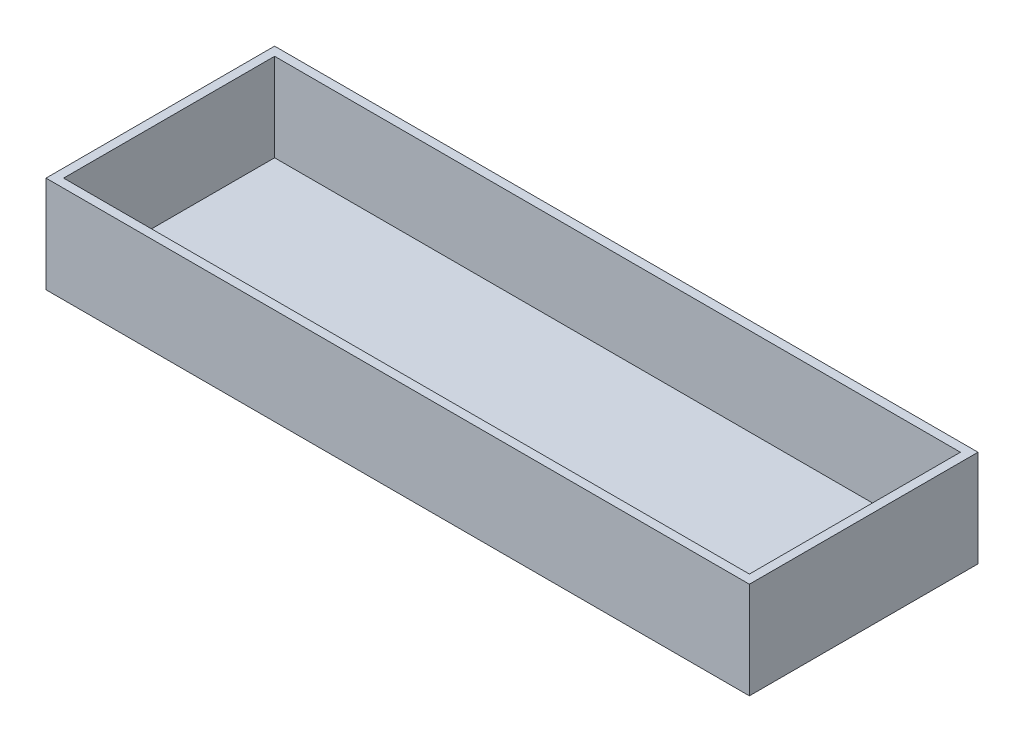
from build123d import *

# Parameters (mm, degrees)
SKETCH1_W           = 160
SKETCH1_H           = 52
BOSS_EXTRUDE1_DEPTH = 22
SHELL1_T            = -2


with BuildPart() as part:
    # Sketch1 → Boss-Extrude1 (new body)
    with BuildSketch(Plane(origin=(0, 0, 0), x_dir=(1, 0, 0), z_dir=(0, 1, 0))):
        with Locations((80, 26)):
            Rectangle(SKETCH1_W, SKETCH1_H)
    extrude(amount=BOSS_EXTRUDE1_DEPTH)

    # Shell1
    shell1_openings = [part.faces().sort_by_distance(p)[0] for p in [
        (80, 22, -26),
    ]]
    offset(amount=SHELL1_T, openings=shell1_openings, kind=Kind.INTERSECTION)


solid = part.part
